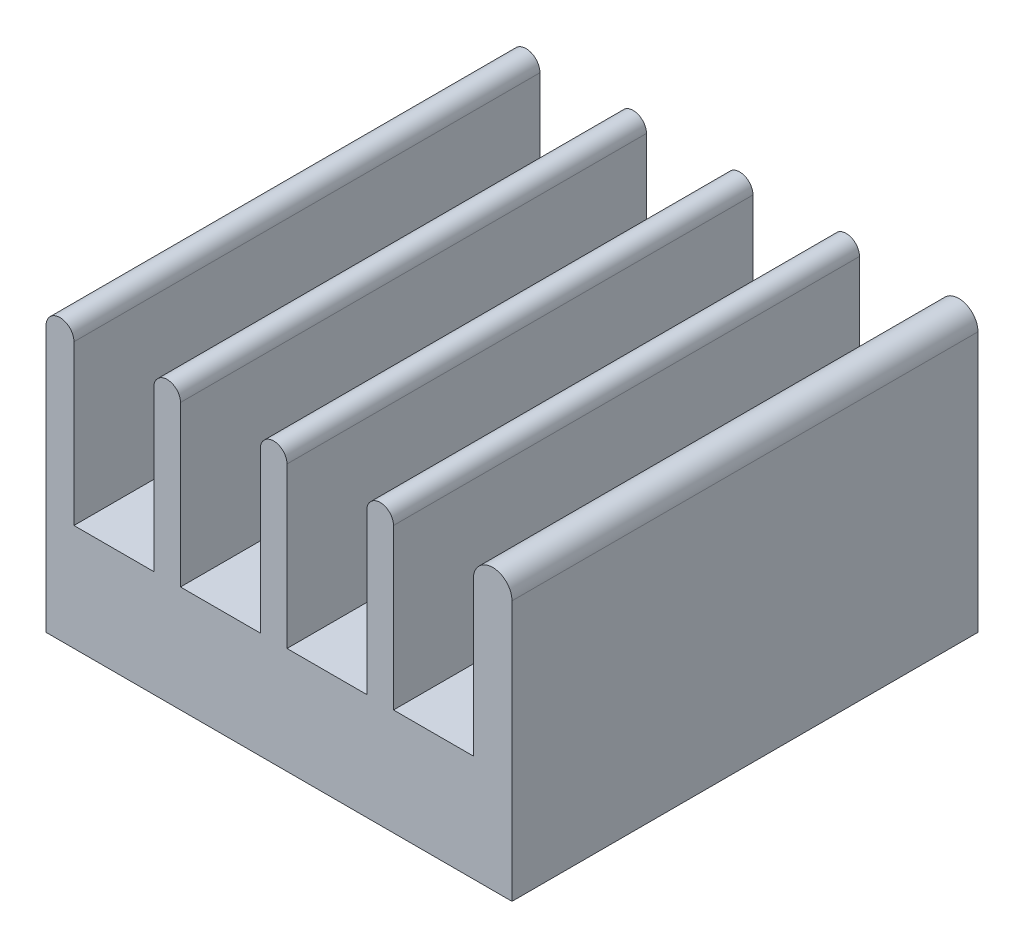
from build123d import *

# Parameters (mm, degrees)
SKETCH1_W           = 8.89
SKETCH1_H           = 8.89
BOSS_EXTRUDE1_DEPTH = 5.334
SKETCH2_W           = 1.524
SKETCH2_H           = 8.89
CUT_EXTRUDE1_DEPTH  = 3.302
FILLET3_RADIUS      = 0.3683
FILLET3_LENGTH      = 8.89
FILLET4_RADIUS      = 0.254
FILLET4_LENGTH      = 8.89
FILLET5_RADIUS      = 0.254
FILLET5_LENGTH      = 8.89
FILLET6_RADIUS      = 0.254
FILLET6_LENGTH      = 8.89
FILLET7_RADIUS      = 0.2667
FILLET7_LENGTH      = 8.89


with BuildPart() as part:
    # Sketch1 → Boss-Extrude1 (new body)
    with BuildSketch(Plane(origin=(0, 0, 0), x_dir=(1, 0, 0), z_dir=(0, 1, 0))):
        Rectangle(SKETCH1_W, SKETCH1_H)
    extrude(amount=BOSS_EXTRUDE1_DEPTH)

    # Sketch2 → Cut-Extrude1 (cut)
    with BuildSketch(Plane(origin=(0, 5.334, 0), x_dir=(1, 0, 0), z_dir=(0, 1, 0))):
        with Locations((-3.1496, 0)):
            Rectangle(SKETCH2_W, SKETCH2_H)
        with Locations((-1.1176, 0)):
            Rectangle(SKETCH2_W, SKETCH2_H)
        with Locations((0.9144, 0)):
            Rectangle(SKETCH2_W, SKETCH2_H)
        with Locations((2.9464, 0)):
            Rectangle(SKETCH2_W, SKETCH2_H)
    extrude(amount=-CUT_EXTRUDE1_DEPTH, mode=Mode.SUBTRACT)

    # Fillet3: full round fillet: the end face becomes a half cylinder, R = half its width
    fillet3_face = Plane((4.0767, 5.334, 0), x_dir=(0, 0, -1), z_dir=(0, 1, 0))  # on the end face: x along it, z out of the body
    fillet3_slab = fillet3_face.offset(-FILLET3_RADIUS / 2) * Box(FILLET3_LENGTH, 2 * FILLET3_RADIUS, FILLET3_RADIUS, mode=Mode.PRIVATE)  # the body's end, R deep
    fillet3_round = Plane((4.0767, 4.9657, 0), x_dir=(0, 1, 0), z_dir=(0, 0, -1)) * Cylinder(FILLET3_RADIUS, FILLET3_LENGTH, mode=Mode.PRIVATE)  # its axis R under the face
    add(fillet3_slab - fillet3_round, mode=Mode.SUBTRACT)

    # Fillet4: full round fillet: the end face becomes a half cylinder, R = half its width
    fillet4_face = Plane((1.9304, 5.334, 0), x_dir=(0, 0, 1), z_dir=(0, 1, 0))  # on the end face: x along it, z out of the body
    fillet4_slab = fillet4_face.offset(-FILLET4_RADIUS / 2) * Box(FILLET4_LENGTH, 2 * FILLET4_RADIUS, FILLET4_RADIUS, mode=Mode.PRIVATE)  # the body's end, R deep
    fillet4_round = Plane((1.9304, 5.08, 0), x_dir=(0, 1, 0), z_dir=(0, 0, 1)) * Cylinder(FILLET4_RADIUS, FILLET4_LENGTH, mode=Mode.PRIVATE)  # its axis R under the face
    add(fillet4_slab - fillet4_round, mode=Mode.SUBTRACT)

    # Fillet5: full round fillet: the end face becomes a half cylinder, R = half its width
    fillet5_face = Plane((-0.1016, 5.334, 0), x_dir=(0, 0, 1), z_dir=(0, 1, 0))  # on the end face: x along it, z out of the body
    fillet5_slab = fillet5_face.offset(-FILLET5_RADIUS / 2) * Box(FILLET5_LENGTH, 2 * FILLET5_RADIUS, FILLET5_RADIUS, mode=Mode.PRIVATE)  # the body's end, R deep
    fillet5_round = Plane((-0.1016, 5.08, 0), x_dir=(0, 1, 0), z_dir=(0, 0, 1)) * Cylinder(FILLET5_RADIUS, FILLET5_LENGTH, mode=Mode.PRIVATE)  # its axis R under the face
    add(fillet5_slab - fillet5_round, mode=Mode.SUBTRACT)

    # Fillet6: full round fillet: the end face becomes a half cylinder, R = half its width
    fillet6_face = Plane((-2.1336, 5.334, 0), x_dir=(0, 0, 1), z_dir=(0, 1, 0))  # on the end face: x along it, z out of the body
    fillet6_slab = fillet6_face.offset(-FILLET6_RADIUS / 2) * Box(FILLET6_LENGTH, 2 * FILLET6_RADIUS, FILLET6_RADIUS, mode=Mode.PRIVATE)  # the body's end, R deep
    fillet6_round = Plane((-2.1336, 5.08, 0), x_dir=(0, 1, 0), z_dir=(0, 0, 1)) * Cylinder(FILLET6_RADIUS, FILLET6_LENGTH, mode=Mode.PRIVATE)  # its axis R under the face
    add(fillet6_slab - fillet6_round, mode=Mode.SUBTRACT)

    # Fillet7: full round fillet: the end face becomes a half cylinder, R = half its width
    fillet7_face = Plane((-4.1783, 5.334, 0), x_dir=(0, 0, 1), z_dir=(0, 1, 0))  # on the end face: x along it, z out of the body
    fillet7_slab = fillet7_face.offset(-FILLET7_RADIUS / 2) * Box(FILLET7_LENGTH, 2 * FILLET7_RADIUS, FILLET7_RADIUS, mode=Mode.PRIVATE)  # the body's end, R deep
    fillet7_round = Plane((-4.1783, 5.0673, 0), x_dir=(0, 1, 0), z_dir=(0, 0, 1)) * Cylinder(FILLET7_RADIUS, FILLET7_LENGTH, mode=Mode.PRIVATE)  # its axis R under the face
    add(fillet7_slab - fillet7_round, mode=Mode.SUBTRACT)


solid = part.part
